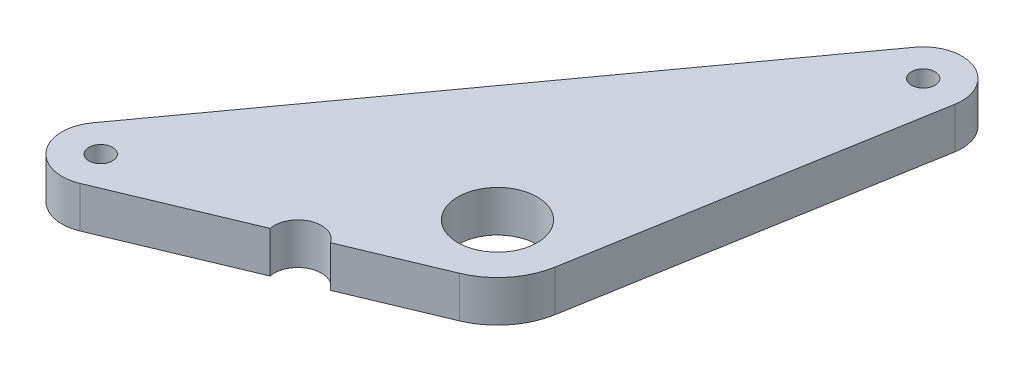
from build123d import *

# Parameters (mm, degrees)
SKETCH1_W                  = 355.6
SKETCH1_H                  = 77.724
BOSS_EXTRUDE1_DEPTH        = 22.225
SKETCH2_W                  = 74.549
SKETCH2_H                  = 19.05
CUT_EXTRUDE1_DEPTH         = 364.67400769
SKETCH3_W                  = 25.4
SKETCH3_H                  = 3.937
CUT_EXTRUDE2_DEPTH         = 817.444922817
SKETCH4_W                  = 330.2
SKETCH4_H                  = 3.175
BOSS_EXTRUDE2_DEPTH        = 15.875
SKETCH5_W                  = 69.85
SKETCH5_H                  = 3.175
BOSS_EXTRUDE3_DEPTH        = 457.2
SKETCH6_W                  = 330.2
SKETCH6_H                  = 3.175
BOSS_EXTRUDE4_DEPTH        = 3.937
SKETCH7_W                  = 330.2
SKETCH7_H                  = 3.175
BOSS_EXTRUDE5_DEPTH        = 15.875
SKETCH8_W                  = 355.6
SKETCH8_H                  = 3.175
BOSS_EXTRUDE6_DEPTH        = 3.937
SKETCH9_W                  = 355.6
SKETCH9_H                  = 3.175
BOSS_EXTRUDE7_DEPTH        = 19.05
SKETCH10_W                 = 76.358809824
SKETCH10_H                 = 3.175
BOSS_EXTRUDE8_DEPTH        = 27.432
SKETCH11_W                 = 124.052954744
SKETCH11_H                 = 3.175
BOSS_EXTRUDE9_DEPTH        = 19.05
DRAFT1_ANGLE               = 30
DRAFT2_ANGLE               = 19
M20_CLEARANCE_HOLE1_D      = 22.225
M20_CLEARANCE_HOLE1_DEPTH  = 19.050025
HOLE1_D                    = 8.128
HOLE1_DEPTH                = 22.225
M25_CLEARANCE_HOLE1_D      = 28.575
M25_CLEARANCE_HOLE1_DEPTH  = 22.225
M3_CLEARANCE_HOLE1_D       = 3.571875
M3_CLEARANCE_HOLE1_DEPTH   = 22.225
M2_CLEARANCE_HOLE1_D       = 2.54
M2_CLEARANCE_HOLE1_DEPTH   = 22.225
M3_5_CLEARANCE_HOLE1_D     = 4.064
M3_5_CLEARANCE_HOLE1_DEPTH = 22.225
HOLE2_D                    = 5.08
HOLE2_DEPTH                = 22.225
M25_CLEARANCE_HOLE2_D      = 28.575
M25_CLEARANCE_HOLE2_DEPTH  = 19.050025
HOLE3_D                    = 5.1054
HOLE3_DEPTH                = 19.050025
HOLE4_D                    = 8.128
HOLE4_DEPTH                = 19.050025
M3_CLEARANCE_HOLE2_D       = 3.571875
M3_CLEARANCE_HOLE2_DEPTH   = 19.050025
M6_CLEARANCE_HOLE1_D       = 6.7056
M6_CLEARANCE_HOLE1_DEPTH   = 22.225
M6_CLEARANCE_HOLE2_D       = 6.7056
M6_CLEARANCE_HOLE2_DEPTH   = 101.219
M5_CLEARANCE_HOLE1_D       = 5.334
M5_CLEARANCE_HOLE1_DEPTH   = 92.837
CHAMFER1_SIZE              = 3.175
FILLET1_R                  = 0.762
FILLET2_R                  = 3.175
FILLET3_R                  = 3.937
CUT_EXTRUDE3_DEPTH         = 819.902667079
CUT_EXTRUDE3_DEPTH_BACK    = 819.902667079
BOSS_EXTRUDE10_START       = -3.175
SKETCH45_W                 = 177.8
SKETCH45_H                 = 304.8
SKETCH45_R                 = 2.54
SKETCH45_R_2               = 14.2875
SKETCH45_R_3               = 2.032
SKETCH45_R_4               = 3.3528
BOSS_EXTRUDE10_DEPTH       = 3.175
SKETCH61_R                 = 9.652
SKETCH61_R_2               = 14.351
CUT_EXTRUDE16_DEPTH        = 556.389125447
SKETCH59_R                 = 9.5
CUT_EXTRUDE17_DEPTH        = 556.389125447
SKETCH62_R                 = 3.175
CUT_EXTRUDE18_DEPTH        = 556.389125447
CUT_EXTRUDE19_DEPTH        = 556.389125447
SKETCH70_R                 = 9.5
SKETCH70_R_2               = 8.5
BOSS_EXTRUDE15_DEPTH       = 3.175
SKETCH73_R                 = 2.54
CUT_EXTRUDE21_DEPTH        = 556.389125447
FILLET9_R                  = 25.4
BOSS_EXTRUDE17_START       = 101.6
SKETCH74_R                 = 2.54
SKETCH74_R_2               = 14.351
SKETCH74_R_3               = 9.5
SKETCH74_R_4               = 6.35
BOSS_EXTRUDE17_DEPTH       = 3.175
SKETCH75_W                 = 279.499497025
SKETCH75_H                 = 356.937981548
CUT_EXTRUDE22_DEPTH        = 566.17678709
SKETCH93_R                 = 2.54
CUT_EXTRUDE32_DEPTH        = 526.348222626
SKETCH98_R                 = 9.6
SKETCH98_R_2               = 2.54
BOSS_EXTRUDE23_DEPTH       = 8.89
SKETCH99_W                 = 685.374390259
SKETCH99_H                 = 496.181227768
CUT_EXTRUDE37_DEPTH        = 526.413843071
SKETCH100_R                = 9.6
SKETCH100_R_2              = 8.54600018
BOSS_EXTRUDE24_DEPTH       = 8.89


with BuildPart() as part:
    # Sketch1 → Boss-Extrude1 (new body)
    with BuildSketch(Plane(origin=(0, 3.175, 0), x_dir=(1, 0, 0), z_dir=(0, 1, 0))):
        with Locations((635, 34.925)):
            Rectangle(SKETCH1_W, SKETCH1_H)
    extrude(amount=-BOSS_EXTRUDE1_DEPTH)

    # Sketch2 → Cut-Extrude1 (cut, through all)
    with BuildSketch(Plane(origin=(812.8, 0, 0), x_dir=(0, 0, -1), z_dir=(1, 0, 0))):
        with Locations((33.3375, -9.525)):
            Rectangle(SKETCH2_W, SKETCH2_H)
    extrude(amount=-CUT_EXTRUDE1_DEPTH, mode=Mode.SUBTRACT)

    # Sketch3 → Cut-Extrude2 (cut, through all)
    with BuildSketch(Plane(origin=(0, 3.175, 0), x_dir=(-1, 0, 0), z_dir=(0, 1, 0))):
        with Locations((-469.9, 1.9685)):
            Rectangle(SKETCH3_W, SKETCH3_H)
    extrude(amount=-CUT_EXTRUDE2_DEPTH, mode=Mode.SUBTRACT)

    # Sketch4 → Boss-Extrude2 (add)
    with BuildSketch(Plane(origin=(0, 3.175, 0), x_dir=(-1, 0, 0), z_dir=(0, 1, 0))):
        with Locations((-647.7, 2.3495)):
            Rectangle(SKETCH4_W, SKETCH4_H)
    extrude(amount=BOSS_EXTRUDE2_DEPTH)

    # Sketch5 → Boss-Extrude3 (add)
    with BuildSketch(Plane.ZY.offset(-457.2)):
        with Locations((-34.925, 1.5875)):
            Rectangle(SKETCH5_W, SKETCH5_H)
    extrude(amount=BOSS_EXTRUDE3_DEPTH)

    # Sketch6 → Boss-Extrude4 (add)
    with BuildSketch(Plane.XY):
        with Locations((165.1, 1.5875)):
            Rectangle(SKETCH6_W, SKETCH6_H)
    extrude(amount=BOSS_EXTRUDE4_DEPTH)

    # Sketch7 → Boss-Extrude5 (add)
    with BuildSketch(Plane(origin=(0, 3.175, 0), x_dir=(-1, 0, 0), z_dir=(0, 1, 0))):
        with Locations((-165.1, 2.3495)):
            Rectangle(SKETCH7_W, SKETCH7_H)
    extrude(amount=BOSS_EXTRUDE5_DEPTH)

    # Sketch8 → Boss-Extrude6 (add)
    with BuildSketch(Plane(origin=(0, 0, -69.85), x_dir=(-1, 0, 0), z_dir=(0, 0, -1))):
        with Locations((-177.8, 1.5875)):
            Rectangle(SKETCH8_W, SKETCH8_H)
    extrude(amount=BOSS_EXTRUDE6_DEPTH)

    # Sketch9 → Boss-Extrude7 (add)
    with BuildSketch(Plane.XZ):
        with Locations((177.8, -72.1995)):
            Rectangle(SKETCH9_W, SKETCH9_H)
    extrude(amount=BOSS_EXTRUDE7_DEPTH)

    # Sketch10 → Boss-Extrude8 (add)
    with BuildSketch(Plane(origin=(0, 0, -69.85), x_dir=(-1, 0, 0), z_dir=(0, 0, -1))):
        with Locations((-406.4, 1.5875)):
            Rectangle(SKETCH10_W, SKETCH10_H)
    extrude(amount=BOSS_EXTRUDE8_DEPTH)

    # Sketch11 → Boss-Extrude9 (add)
    with BuildSketch(Plane.XY):
        with Locations((406.4, 1.5875)):
            Rectangle(SKETCH11_W, SKETCH11_H)
    extrude(amount=BOSS_EXTRUDE9_DEPTH)

    # Draft1
    draft1_faces = [part.faces().sort_by_distance(p)[0] for p in [
        (344.373522628, 1.5875, 9.525),
        (468.426477372, 1.5875, 9.525),
    ]]
    draft(draft1_faces, Plane.XY.offset(19.05), DRAFT1_ANGLE)

    # Draft2
    draft2_faces = [part.faces().sort_by_distance(p)[0] for p in [
        (368.220595088, 1.5875, -83.566),
        (444.579404912, 1.5875, -83.566),
    ]]
    draft(draft2_faces, Plane(origin=(0, 0, -97.282), x_dir=(-1, 0, 0), z_dir=(0, 0, -1)), DRAFT2_ANGLE)

    # M20 Clearance Hole1
    with Locations(Plane(origin=(0, 0, 0), x_dir=(-1, 0, 0), z_dir=(0, -1, 0))):
        with Locations((-624.254637168, 36.83)):
            Hole(M20_CLEARANCE_HOLE1_D / 2, depth=M20_CLEARANCE_HOLE1_DEPTH)

    # Hole1
    with Locations(Plane(origin=(0, 3.175, 0), x_dir=(1, 0, 0), z_dir=(0, 1, 0))):
        with Locations((229.261562832, 36.83), (229.261562832, 62.23), (229.261562832, 11.43)):
            Hole(HOLE1_D / 2, depth=HOLE1_DEPTH)

    # M25 Clearance Hole1
    with Locations(Plane(origin=(0, 3.175, 0), x_dir=(1, 0, 0), z_dir=(0, 1, 0))):
        with Locations((147.829162832, 36.83)):
            Hole(M25_CLEARANCE_HOLE1_D / 2, depth=M25_CLEARANCE_HOLE1_DEPTH)

    # M3 Clearance Hole1
    with Locations(Plane(origin=(0, 3.175, 0), x_dir=(1, 0, 0), z_dir=(0, 1, 0))):
        with Locations((120.600362832, 65.405), (120.600362832, 8.255), (237.440362832, 8.255), (237.440362832, 65.405)):
            Hole(M3_CLEARANCE_HOLE1_D / 2, depth=M3_CLEARANCE_HOLE1_DEPTH)

    # M2 Clearance Hole1
    with Locations(Plane(origin=(0, 3.175, 0), x_dir=(1, 0, 0), z_dir=(0, 1, 0))):
        with Locations((101.6, 3.175), (101.6, 66.675), (50.8, 66.675), (50.8, 3.175), (762, 66.675), (762, 3.175), (711.2, 3.175), (711.2, 66.675)):
            Hole(M2_CLEARANCE_HOLE1_D / 2, depth=M2_CLEARANCE_HOLE1_DEPTH)

    # M3.5 Clearance Hole1
    with Locations(Plane(origin=(0, 3.175, 0), x_dir=(1, 0, 0), z_dir=(0, 1, 0))):
        with Locations((443.992, 87.85352), (368.808, 87.85352), (361.9119, -1.03886), (450.8881, -1.03886)):
            Hole(M3_5_CLEARANCE_HOLE1_D / 2, depth=M3_5_CLEARANCE_HOLE1_DEPTH)

    # Hole2
    with Locations(Plane(origin=(0, 3.175, 0), x_dir=(1, 0, 0), z_dir=(0, 1, 0))):
        with Locations((438.15, 87.85352), (374.65, 87.85352), (445.0461, -1.03886), (367.7539, -1.03886), (115.520362832, 65.405), (115.520362832, 8.255), (242.520362832, 8.255), (242.520362832, 65.405)):
            Hole(HOLE2_D / 2, depth=HOLE2_DEPTH)

    # M25 Clearance Hole2
    with Locations(Plane(origin=(0, 0, 0), x_dir=(-1, 0, 0), z_dir=(0, -1, 0))):
        with Locations((-406.4, 17.272), (-664.970837168, 36.83)):
            Hole(M25_CLEARANCE_HOLE2_D / 2, depth=M25_CLEARANCE_HOLE2_DEPTH)

    # Hole3
    with Locations(Plane(origin=(0, 0, 0), x_dir=(-1, 0, 0), z_dir=(0, -1, 0))):
        with Locations((-570.279637168, 8.255), (-570.279637168, 65.405), (-697.279637168, 65.405), (-697.279637168, 8.255)):
            Hole(HOLE3_D / 2, depth=HOLE3_DEPTH)

    # Hole4
    with Locations(Plane(origin=(0, 0, 0), x_dir=(-1, 0, 0), z_dir=(0, -1, 0))):
        with Locations((-583.538437168, 11.43), (-583.538437168, 36.83), (-583.538437168, 62.23)):
            Hole(HOLE4_D / 2, depth=HOLE4_DEPTH)

    # M3 Clearance Hole2
    with Locations(Plane(origin=(0, 0, 0), x_dir=(-1, 0, 0), z_dir=(0, -1, 0))):
        with Locations((-692.199637168, 8.255), (-692.199637168, 65.405), (-575.359637168, 65.405), (-575.359637168, 8.255)):
            Hole(M3_CLEARANCE_HOLE2_D / 2, depth=M3_CLEARANCE_HOLE2_DEPTH)

    # M6 Clearance Hole1
    with Locations(Plane(origin=(0, 3.175, 0), x_dir=(1, 0, 0), z_dir=(0, 1, 0))):
        with Locations((612.775, 10.287), (498.475, 10.287), (314.325, 10.287), (200.025, 10.287), (628.319218584, 61.976), (184.480781416, 61.976), (690.88, 15.875), (739.902, 9.525), (121.92, 15.875), (72.898, 9.525), (298.874532383, 17.547282407), (513.925467617, 17.547282407), (165.1, 14.732), (266.7, 14.732), (546.1, 14.732), (647.7, 14.732), (330.2, 61.722), (279.4, 61.722), (139.7, 61.722), (25.4, 61.722), (482.6, 61.722), (533.4, 61.722), (673.1, 61.722), (787.4, 61.722), (6.35, 39.497), (806.45, 39.497), (350.8375, -12.8905), (461.9625, -12.8905)):
            Hole(M6_CLEARANCE_HOLE1_D / 2, depth=M6_CLEARANCE_HOLE1_DEPTH)

    # M6 Clearance Hole2
    with Locations(Plane.XY.offset(3.937)):
        with Locations((495.3, 12.7), (520.7, 12.7), (546.1, 12.7), (571.5, 12.7), (596.9, 12.7), (622.3, 12.7), (647.7, 12.7), (673.1, 12.7), (698.5, 12.7), (723.9, 12.7), (749.3, 12.7), (774.7, 12.7), (800.1, 12.7), (317.5, 12.7), (292.1, 12.7), (266.7, 12.7), (241.3, 12.7), (215.9, 12.7), (190.5, 12.7), (165.1, 12.7), (139.7, 12.7), (114.3, 12.7), (88.9, 12.7), (63.5, 12.7), (12.7, 12.7), (38.1, 12.7)):
            Hole(M6_CLEARANCE_HOLE2_D / 2, depth=M6_CLEARANCE_HOLE2_DEPTH)

    # M5 Clearance Hole1
    with Locations(Plane(origin=(0, 0, -73.787), x_dir=(-1, 0, 0), z_dir=(0, 0, -1))):
        with Locations((-469.9, -12.7), (-495.3, -12.7), (-520.7, -12.7), (-546.1, -12.7), (-571.5, -12.7), (-596.9, -12.7), (-622.3, -12.7), (-647.7, -12.7), (-673.1, -12.7), (-698.5, -12.7), (-723.9, -12.7), (-749.3, -12.7), (-774.7, -12.7), (-800.1, -12.7), (-342.9, -12.7), (-317.5, -12.7), (-292.1, -12.7), (-266.7, -12.7), (-241.3, -12.7), (-215.9, -12.7), (-190.5, -12.7), (-165.1, -12.7), (-139.7, -12.7), (-114.3, -12.7), (-88.9, -12.7), (-63.5, -12.7), (-38.1, -12.7), (-12.7, -12.7)):
            Hole(M5_CLEARANCE_HOLE1_D / 2, depth=M5_CLEARANCE_HOLE1_DEPTH)

    # Chamfer1
    chamfer1_edges = [part.edges().sort_by_distance(p)[0] for p in [
        (482.6, 19.05, 2.3495),
        (0, 19.05, 2.3495),
        (812.8, 19.05, 2.3495),
        (812.8, -19.05, -72.1995),
        (457.2, -19.05, -72.1995),
        (0, -19.05, -72.1995),
        (330.2, 19.05, 2.3495),
        (355.6, -19.05, -72.1995),
    ]]
    chamfer(chamfer1_edges, length=CHAMFER1_SIZE)

    # Fillet1
    fillet1_edges = [part.edges().sort_by_distance(p)[0] for p in [
        (647.7, 3.175, 0.762),
        (177.8, 0, -70.612),
        (635, 0, -70.612),
        (165.1, 3.175, 0.762),
    ]]
    fillet(fillet1_edges, radius=FILLET1_R)

    # Fillet2
    fillet2_edges = [part.edges().sort_by_distance(p)[0] for p in [
        (368.220595088, 1.5875, -97.282),
        (333.375, 1.5875, 0),
        (344.373522628, 1.5875, 19.05),
        (444.579404912, 1.5875, -97.282),
        (358.775, 1.5875, -69.85),
        (479.425, 1.5875, 0),
        (468.426477372, 1.5875, 19.05),
        (454.025, 1.5875, -69.85),
    ]]
    fillet(fillet2_edges, radius=FILLET2_R)

    # Fillet3
    fillet3_edges = [part.edges().sort_by_distance(p)[0] for p in [
        (165.1, 0, 3.937),
        (647.7, 0, 3.937),
        (635, 3.175, -73.787),
        (177.8, 3.175, -73.787),
    ]]
    fillet(fillet3_edges, radius=FILLET3_R)

    # Sketch44 → Cut-Extrude3 (cut, two sides: drawn at the far end of the back side and taken through both)
    with BuildSketch(Plane(origin=(0, 3.175, 0), x_dir=(1, 0, 0), z_dir=(0, 1, 0)).offset(-CUT_EXTRUDE3_DEPTH_BACK)):
        Polygon((367.483279101, 95.14067889), (343.456979076, -17.4625), (339.564298226, -35.70618453), (-19.786749283, -35.70618453), (-19.786749283, 120.609234526), (367.483279101, 120.609234526), align=None)
        Polygon((445.316720899, 95.14067889), (445.316720899, 120.609234526), (832.586749283, 120.609234526), (832.586749283, -35.70618453), (473.235701774, -35.70618453), (469.343020924, -17.4625), align=None)
    extrude(amount=CUT_EXTRUDE3_DEPTH + CUT_EXTRUDE3_DEPTH_BACK, mode=Mode.SUBTRACT)

    # Sketch45 → Boss-Extrude10 (add)
    with BuildSketch(Plane(origin=(0, 3.175, 0), x_dir=(1, 0, 0), z_dir=(0, 1, 0)).offset(BOSS_EXTRUDE10_START)):
        with Locations((392.1125, 125.222)):
            Rectangle(SKETCH45_W, SKETCH45_H)
        with Locations(Location((374.65, 87.85352, 0), (0, 0, 270))):
            Circle(SKETCH45_R, mode=Mode.SUBTRACT)
        with Locations(Location((406.4, 17.272, 0), (0, 0, 90))):
            Circle(SKETCH45_R_2, mode=Mode.SUBTRACT)
        with Locations(Location((368.808, 87.85352, 0), (0, 0, 270))):
            Circle(SKETCH45_R_3, mode=Mode.SUBTRACT)
        with Locations(Location((438.15, 87.85352, 0), (0, 0, 270))):
            Circle(SKETCH45_R, mode=Mode.SUBTRACT)
        with Locations(Location((443.992, 87.85352, 0), (0, 0, 270))):
            Circle(SKETCH45_R_3, mode=Mode.SUBTRACT)
        with Locations(Location((445.0461, -1.03886, 0), (0, 0, 270))):
            Circle(SKETCH45_R, mode=Mode.SUBTRACT)
        with Locations(Location((450.8881, -1.03886, 0), (0, 0, 270))):
            Circle(SKETCH45_R_3, mode=Mode.SUBTRACT)
        with Locations(Location((461.9625, -12.8905, 0), (0, 0, 270))):
            Circle(SKETCH45_R_4, mode=Mode.SUBTRACT)
        with Locations(Location((367.7539, -1.03886, 0), (0, 0, 270))):
            Circle(SKETCH45_R, mode=Mode.SUBTRACT)
        with Locations(Location((361.9119, -1.03886, 0), (0, 0, 270))):
            Circle(SKETCH45_R_3, mode=Mode.SUBTRACT)
        with Locations(Location((350.8375, -12.8905, 0), (0, 0, 270))):
            Circle(SKETCH45_R_4, mode=Mode.SUBTRACT)
    extrude(amount=BOSS_EXTRUDE10_DEPTH)

    # Sketch61 → Cut-Extrude16 (cut, through all)
    with BuildSketch(Plane(origin=(0, 3.175, 0), x_dir=(1, 0, 0), z_dir=(0, 1, 0))):
        with Locations(Location((354.59, 181.205026561, 0), (0, 0, 270))):
            Circle(SKETCH61_R)
        with Locations(Location((427.755496639, 227.083776561, 0), (0, 0, 270))):
            Circle(SKETCH61_R)
        with Locations(Location((427.755496639, 145.803776561, 0), (0, 0, 270))):
            Circle(SKETCH61_R_2)
    extrude(amount=-CUT_EXTRUDE16_DEPTH, mode=Mode.SUBTRACT)

    # Sketch59 → Cut-Extrude17 (cut, through all)
    with BuildSketch(Plane(origin=(0, 3.175, 0), x_dir=(1, 0, 0), z_dir=(0, 1, 0))):
        with Locations(Location((348.684503149, 23.009719341, 0), (0, 0, 270))):
            Circle(SKETCH59_R)
    extrude(amount=-CUT_EXTRUDE17_DEPTH, mode=Mode.SUBTRACT)

    # Sketch62 → Cut-Extrude18 (cut, through all)
    with BuildSketch(Plane(origin=(0, 3.175, 0), x_dir=(1, 0, 0), z_dir=(0, 1, 0))):
        with Locations(Location((354.59, 206.605026561, 0), (0, 0, 270))):
            Circle(SKETCH62_R)
        with Locations(Location((354.59, 155.805026561, 0), (0, 0, 270))):
            Circle(SKETCH62_R)
        with Locations(Location((402.355496639, 227.083776561, 0), (0, 0, 270))):
            Circle(SKETCH62_R)
        with Locations(Location((453.155496639, 227.083776561, 0), (0, 0, 270))):
            Circle(SKETCH62_R)
    extrude(amount=-CUT_EXTRUDE18_DEPTH, mode=Mode.SUBTRACT)

    # Sketch64 → Cut-Extrude19 (cut, through all)
    with BuildSketch(Plane(origin=(0, 3.175, 0), x_dir=(1, 0, 0), z_dir=(0, 1, 0))):
        with BuildLine():
            Line((303.2125, 150.622), (303.2125, 277.622))
            Line((303.2125, 277.622), (430.2125, 277.622))
            ThreePointArc((430.2125, 277.622), (340.409938789, 240.424561211), (303.2125, 150.622))
        make_face()
    extrude(amount=-CUT_EXTRUDE19_DEPTH, mode=Mode.SUBTRACT)

    # Sketch70 → Boss-Extrude15 (add)
    with BuildSketch(Plane(origin=(0, 3.175, 0), x_dir=(1, 0, 0), z_dir=(0, 1, 0))):
        with Locations((348.684503149, 23.009719341)):
            Circle(SKETCH70_R)
        with Locations(Location((348.684503149, 23.009719341, 0), (0, 0, 270))):
            Circle(SKETCH70_R_2, mode=Mode.SUBTRACT)
    extrude(amount=-BOSS_EXTRUDE15_DEPTH)

    # Sketch73 → Cut-Extrude21 (cut, through all)
    with BuildSketch(Plane(origin=(0, 3.175, 0), x_dir=(1, 0, 0), z_dir=(0, 1, 0))):
        with Locations(Location((453.155496639, 69.943578721, 0), (0, 0, 270))):
            Circle(SKETCH73_R)
        with Locations(Location((461.9625, 190.253776561, 0), (0, 0, 270))):
            Circle(SKETCH73_R)
        with Locations(Location((345.205496639, 120.403776561, 0), (0, 0, 270))):
            Circle(SKETCH73_R)
        with Locations(Location((388.219999894, 84.406747951, 0), (0, 0, 270))):
            Circle(SKETCH73_R)
        with Locations(Location((313.759503149, -18.265280659, 0), (0, 0, 270))):
            Circle(SKETCH73_R)
    extrude(amount=-CUT_EXTRUDE21_DEPTH, mode=Mode.SUBTRACT)

    # Fillet9
    fillet9_edges = [part.edges().sort_by_distance(p)[0] for p in [
        (481.0125, 1.5875, 27.178),
        (481.0125, 1.5875, -277.622),
    ]]
    fillet(fillet9_edges, radius=FILLET9_R)

    # Sketch75 → Cut-Extrude22 (cut, through all)
    with BuildSketch(Plane(origin=(0, 3.175, 0), x_dir=(1, 0, 0), z_dir=(0, 1, 0))):
        with Locations((372.338031056, 109.356950247)):
            Rectangle(SKETCH75_W, SKETCH75_H)
    extrude(amount=-CUT_EXTRUDE22_DEPTH, mode=Mode.SUBTRACT)


with BuildPart() as body_2:
    # Sketch74 → Boss-Extrude17 (new body)
    with BuildSketch(Plane(origin=(0, 3.175, 0), x_dir=(1, 0, 0), z_dir=(0, 1, 0)).offset(BOSS_EXTRUDE17_START)):
        with BuildLine():
            Line((303.501804087, -11.782702808), (332.794800726, 123.099073753))
            ThreePointArc((332.794800726, 123.099073753), (334.793445529, 127.675584568), (338.402025721, 131.127711635))
            Line((338.402025721, 131.127711635), (461.509029081, 209.229165205))
            ThreePointArc((461.509029081, 209.229165205), (475.073661576, 209.255890303), (480.92514682, 197.018239818))
            Line((480.92514682, 197.018239818), (465.768143459, 68.456588408))
            ThreePointArc((465.768143459, 68.456588408), (463.858984359, 63.107984333), (459.809495756, 59.126264093))
            Line((459.809495756, 59.126264093), (322.566499117, -25.295314628))
            ThreePointArc((322.566499117, -25.295314628), (308.568620981, -24.839343588), (303.501804087, -11.782702808))
        make_face()
        with Locations(Location((453.155496639, 69.943578721, 0), (0, 0, 270))):
            Circle(SKETCH74_R, mode=Mode.SUBTRACT)
        with Locations(Location((461.9625, 190.253776561, 0), (0, 0, 270))):
            Circle(SKETCH74_R, mode=Mode.SUBTRACT)
        with Locations(Location((345.205496639, 120.403776561, 0), (0, 0, 270))):
            Circle(SKETCH74_R, mode=Mode.SUBTRACT)
        with Locations(Location((388.219999894, 84.406747951, 0), (0, 0, 270))):
            Circle(SKETCH74_R, mode=Mode.SUBTRACT)
        with Locations(Location((313.759503149, -18.265280659, 0), (0, 0, 270))):
            Circle(SKETCH74_R, mode=Mode.SUBTRACT)
        with Locations(Location((427.755496639, 145.803776561, 0), (0, 0, 270))):
            Circle(SKETCH74_R_2, mode=Mode.SUBTRACT)
        with Locations(Location((348.684503149, 23.009719341, 0), (0, 0, 270))):
            Circle(SKETCH74_R_3, mode=Mode.SUBTRACT)
        with Locations(Location((420.687748267, 77.175163336, 0), (0, 0, 270))):
            Circle(SKETCH74_R_4, mode=Mode.SUBTRACT)
        with Locations(Location((371.729, 87.85352, 0), (0, 0, 270))):
            Circle(SKETCH74_R_4, mode=Mode.SUBTRACT)
        with Locations(Location((441.071, 87.85352, 0), (0, 0, 270))):
            Circle(SKETCH74_R_4, mode=Mode.SUBTRACT)
    extrude(amount=BOSS_EXTRUDE17_DEPTH)

    # Sketch93 → Cut-Extrude32 (cut, through all)
    with BuildSketch(Plane(origin=(0, 107.95, 0), x_dir=(1, 0, 0), z_dir=(0, 1, 0))):
        with Locations(Location((335.984503149, 61.109719341, 0), (0, 0, 270))):
            Circle(SKETCH93_R)
        with Locations(Location((361.384503149, 61.109719341, 0), (0, 0, 270))):
            Circle(SKETCH93_R)
    extrude(amount=-CUT_EXTRUDE32_DEPTH, mode=Mode.SUBTRACT)

    # Sketch98 → Boss-Extrude23 (add)
    with BuildSketch(Plane.XZ.offset(-104.775)):
        with BuildLine():
            Line((345.855456024, 13.883292938), (316.979331854, 25.962493289))
            ThreePointArc((316.979331854, 25.962493289), (307.218453945, 23.444957721), (307.005227372, 13.366899509))
            Line((307.005227372, 13.366899509), (381.465724117, -89.305129101))
            ThreePointArc((381.465724117, -89.305129101), (391.463952816, -92.093824678), (396.441551668, -82.985317126))
            Line((396.441551668, -82.985317126), (383.756046671, -9.612392997))
            ThreePointArc((383.756046671, -9.612392997), (380.656766474, -2.710282486), (374.620066838, 1.85073985))
            Line((374.620066838, 1.85073985), (355.042542418, 10.04023365))
            ThreePointArc((355.042542418, 10.04023365), (348.877089577, 8.204009738), (345.855456024, 13.883292938))
        make_face()
        with Locations(Location((368.738835568, -12.208730934, 0), (0, 0, 94.54136383))):
            Circle(SKETCH98_R, mode=Mode.SUBTRACT)
        with Locations(Location((313.759503149, 18.265280659, 0), (0, 0, 270))):
            Circle(SKETCH98_R_2, mode=Mode.SUBTRACT)
        with Locations(Location((388.219999894, -84.406747951, 0), (0, 0, 270))):
            Circle(SKETCH98_R_2, mode=Mode.SUBTRACT)
    extrude(amount=BOSS_EXTRUDE23_DEPTH)

    # Sketch99 → Cut-Extrude37 (cut, through all)
    with BuildSketch(Plane.XZ.offset(-104.775)):
        with Locations((276.11072449, -84.64354836)):
            Rectangle(SKETCH99_W, SKETCH99_H)
    extrude(amount=-CUT_EXTRUDE37_DEPTH, mode=Mode.SUBTRACT)

    # Sketch100 → Boss-Extrude24 (add, through all)
    with BuildSketch(Plane.XZ.offset(-95.885)):
        with Locations((368.738835568, -12.208730934)):
            Circle(SKETCH100_R)
        with Locations(Location((368.738835568, -12.208730934, 0), (0, 0, 270))):
            Circle(SKETCH100_R_2, mode=Mode.SUBTRACT)
    extrude(amount=-BOSS_EXTRUDE24_DEPTH)


solid = body_2.part
